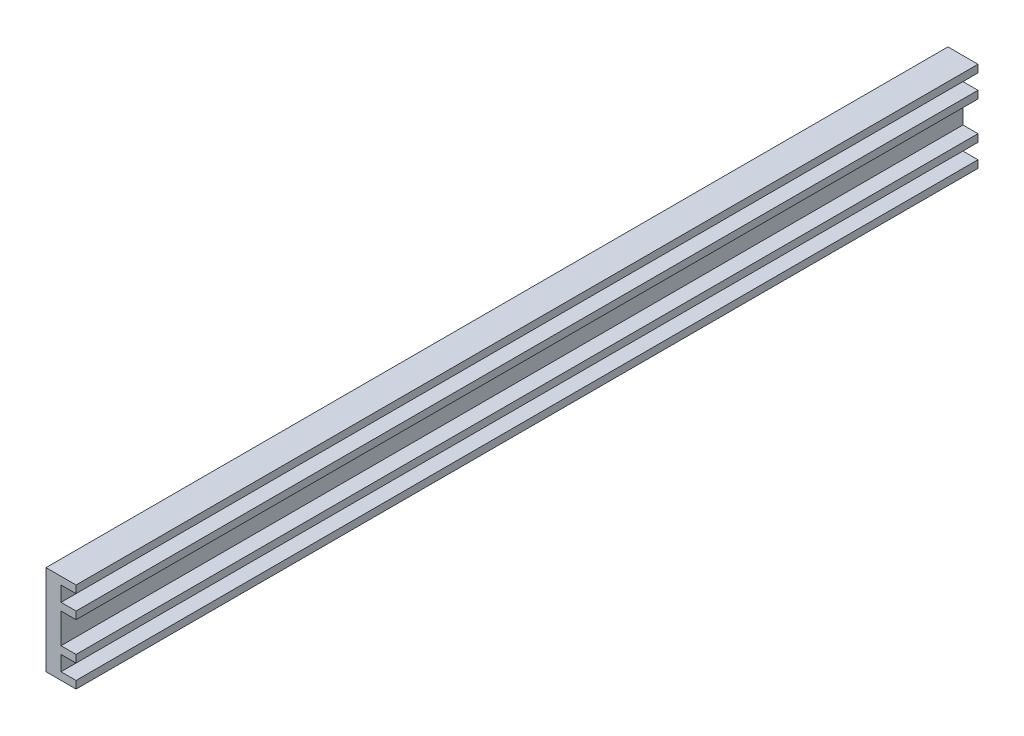
from build123d import *

# Parameters (mm, degrees)
SKETCH1_W           = 6.35
SKETCH1_H           = 19.05
BOSS_EXTRUDE1_DEPTH = 190.5
CUT_EXTRUDE2_REACH  = 193.555
SKETCH3_W           = 3.175
SKETCH3_H           = 6.35
SKETCH3_H_2         = 3.175


with BuildPart() as part:
    # Sketch1 → Boss-Extrude1 (new body)
    with BuildSketch(Plane.XY):
        with Locations((3.175, 9.525)):
            Rectangle(SKETCH1_W, SKETCH1_H)
    extrude(amount=BOSS_EXTRUDE1_DEPTH)

    # Sketch3 → Cut-Extrude2 (cut, up to next)
    with BuildSketch(Plane.XY.offset(190.5), mode=Mode.PRIVATE) as cut_extrude2_sk1:
        with Locations((4.7625, 9.525)):
            Rectangle(SKETCH3_W, SKETCH3_H)
    cut_extrude2_tool1 = extrude(cut_extrude2_sk1.sketch, amount=-CUT_EXTRUDE2_REACH, mode=Mode.PRIVATE) & part.part
    # Sketch3 → Cut-Extrude2 (cut, up to next)
    with BuildSketch(Plane.XY.offset(190.5), mode=Mode.PRIVATE) as cut_extrude2_sk2:
        with Locations((4.7625, 15.875)):
            Rectangle(SKETCH3_W, SKETCH3_H_2)
    cut_extrude2_tool2 = extrude(cut_extrude2_sk2.sketch, amount=-CUT_EXTRUDE2_REACH, mode=Mode.PRIVATE) & part.part
    # Sketch3 → Cut-Extrude2 (cut, up to next)
    with BuildSketch(Plane.XY.offset(190.5), mode=Mode.PRIVATE) as cut_extrude2_sk3:
        with Locations((4.7625, 3.175)):
            Rectangle(SKETCH3_W, SKETCH3_H_2)
    cut_extrude2_tool3 = extrude(cut_extrude2_sk3.sketch, amount=-CUT_EXTRUDE2_REACH, mode=Mode.PRIVATE) & part.part
    add(cut_extrude2_tool1.solids().sort_by_distance((4.7625, 9.525, 190.5))[0], mode=Mode.SUBTRACT)
    add(cut_extrude2_tool2.solids().sort_by_distance((4.7625, 15.875, 190.5))[0], mode=Mode.SUBTRACT)
    add(cut_extrude2_tool3.solids().sort_by_distance((4.7625, 3.175, 190.5))[0], mode=Mode.SUBTRACT)


solid = part.part
